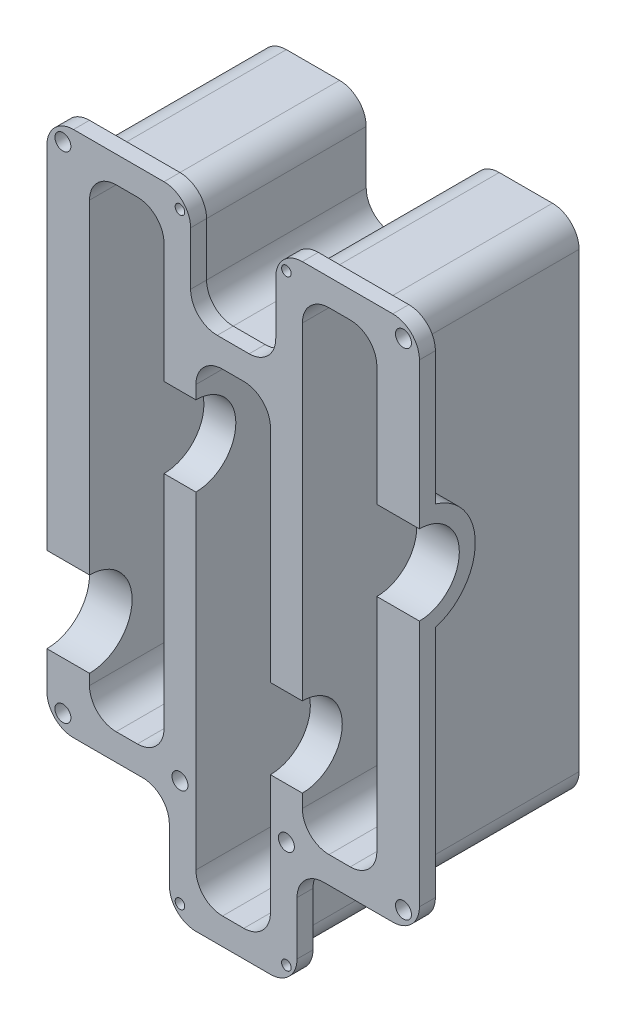
from build123d import *

# Parameters (mm, degrees)
SKETCH1_W           = 70
SKETCH1_H           = 119
BOSS_EXTRUDE1_DEPTH = 35
SKETCH2_R           = 8
CUT_EXTRUDE1_DEPTH  = 8
CUT_EXTRUDE2_DEPTH  = 32
SKETCH4_R           = 7.5
CUT_EXTRUDE3_DEPTH  = 8
SKETCH5_W           = 16
SKETCH5_H           = 20
SKETCH5_W_2         = 23
CUT_EXTRUDE4_DEPTH  = 78.396705356
CUT_EXTRUDE5_DEPTH  = 5
SKETCH7_W           = 18
SKETCH7_H           = 32
CUT_EXTRUDE6_DEPTH  = 2
SKETCH8_W           = 32
SKETCH8_H           = 22
CUT_EXTRUDE7_DEPTH  = 2
SKETCH9_W           = 22
SKETCH9_H           = 32
CUT_EXTRUDE8_DEPTH  = 2
SKETCH10_W          = 32
SKETCH10_H          = 18
CUT_EXTRUDE9_DEPTH  = 2
SKETCH11_W          = 25
SKETCH11_H          = 32
CUT_EXTRUDE10_DEPTH = 2
CUT_EXTRUDE11_DEPTH = 5
SKETCH13_W          = 22
SKETCH13_H          = 32
CUT_EXTRUDE12_DEPTH = 2
SKETCH14_W          = 32
SKETCH14_H          = 18
CUT_EXTRUDE13_DEPTH = 2
SKETCH15_W          = 18
SKETCH15_H          = 32
CUT_EXTRUDE14_DEPTH = 2
SKETCH16_W          = 32
SKETCH16_H          = 20
CUT_EXTRUDE15_DEPTH = 2
FILLET1_R           = 5
FILLET3_R           = 5
FILLET4_R           = 5
SKETCH17_R          = 1.5
CUT_EXTRUDE16_DEPTH = 10
SKETCH18_R          = 0.9
CUT_EXTRUDE17_DEPTH = 10
BOSS_EXTRUDE2_START = -6
BOSS_EXTRUDE2_DEPTH = 6
BOSS_EXTRUDE3_DEPTH = 6


with BuildPart() as part:
    # Sketch1 → Boss-Extrude1 (new body)
    with BuildSketch(Plane.XY):
        Rectangle(SKETCH1_W, SKETCH1_H)
    extrude(amount=BOSS_EXTRUDE1_DEPTH)

    # Sketch2 → Cut-Extrude1 (cut)
    with BuildSketch(Plane.ZY.offset(35)):
        with Locations((35, -19.5)):
            Circle(SKETCH2_R)
    extrude(amount=-CUT_EXTRUDE1_DEPTH, mode=Mode.SUBTRACT)

    # Sketch3 → Cut-Extrude2 (cut)
    with BuildSketch(Plane.XY.offset(35)):
        Polygon((-27, -34.5), (-13, -34.5), (-13, 12), (-7, 12), (-7, -54.5), (7, -54.5), (7, -27), (13, -27), (13, -34.5), (27, -34.5), (27, 54.5), (13, 54.5), (13, -12), (7, -12), (7, 34.5), (-7, 34.5), (-7, 27), (-13, 27), (-13, 54.5), (-27, 54.5), align=None)
    extrude(amount=-CUT_EXTRUDE2_DEPTH, mode=Mode.SUBTRACT)

    # Sketch4 → Cut-Extrude3 (cut)
    with BuildSketch(Plane(origin=(35, 0, 0), x_dir=(0, 0, -1), z_dir=(1, 0, 0))):
        with Locations((-35, 19.5)):
            Circle(SKETCH4_R)
    extrude(amount=-CUT_EXTRUDE3_DEPTH, mode=Mode.SUBTRACT)

    # Sketch5 → Cut-Extrude4 (cut, through all)
    with BuildSketch(Plane.XY.offset(35)):
        with Locations((0, 49.5)):
            Rectangle(SKETCH5_W, SKETCH5_H)
        with Locations((23.5, -49.5)):
            Rectangle(SKETCH5_W_2, SKETCH5_H)
        with Locations((-23.5, -49.5)):
            Rectangle(SKETCH5_W_2, SKETCH5_H)
    extrude(amount=-CUT_EXTRUDE4_DEPTH, mode=Mode.SUBTRACT)

    # Sketch6 → Cut-Extrude5 (cut)
    with BuildSketch(Plane.ZY.offset(35)):
        with BuildLine():
            Line((32, 59.5), (0, 59.5))
            Line((0, 59.5), (0, -39.5))
            Line((0, -39.5), (32, -39.5))
            Line((32, -39.5), (32, -30.083005244))
            ThreePointArc((32, -30.083005244), (24, -19.5), (32, -8.916994756))
            Line((32, -8.916994756), (32, 59.5))
        make_face()
    extrude(amount=-CUT_EXTRUDE5_DEPTH, mode=Mode.SUBTRACT)

    # Sketch7 → Cut-Extrude6 (cut)
    with BuildSketch(Plane.XZ.offset(39.5)):
        with Locations((-21, 16)):
            Rectangle(SKETCH7_W, SKETCH7_H)
    extrude(amount=-CUT_EXTRUDE6_DEPTH, mode=Mode.SUBTRACT)

    # Sketch8 → Cut-Extrude7 (cut)
    with BuildSketch(Plane.ZY.offset(12)):
        with Locations((16, -48.5)):
            Rectangle(SKETCH8_W, SKETCH8_H)
    extrude(amount=-CUT_EXTRUDE7_DEPTH, mode=Mode.SUBTRACT)

    # Sketch9 → Cut-Extrude8 (cut)
    with BuildSketch(Plane.XZ.offset(59.5)):
        with Locations((1, 16)):
            Rectangle(SKETCH9_W, SKETCH9_H)
    extrude(amount=-CUT_EXTRUDE8_DEPTH, mode=Mode.SUBTRACT)

    # Sketch10 → Cut-Extrude9 (cut)
    with BuildSketch(Plane(origin=(12, 0, 0), x_dir=(0, 0, -1), z_dir=(1, 0, 0))):
        with Locations((-16, -48.5)):
            Rectangle(SKETCH10_W, SKETCH10_H)
    extrude(amount=-CUT_EXTRUDE9_DEPTH, mode=Mode.SUBTRACT)

    # Sketch11 → Cut-Extrude10 (cut)
    with BuildSketch(Plane.XZ.offset(39.5)):
        with Locations((22.5, 16)):
            Rectangle(SKETCH11_W, SKETCH11_H)
    extrude(amount=-CUT_EXTRUDE10_DEPTH, mode=Mode.SUBTRACT)

    # Sketch12 → Cut-Extrude11 (cut)
    with BuildSketch(Plane(origin=(35, 0, 0), x_dir=(0, 0, -1), z_dir=(1, 0, 0))):
        with BuildLine():
            Line((-32, 59.5), (0, 59.5))
            Line((0, 59.5), (0, -37.5))
            Line((0, -37.5), (-32, -37.5))
            Line((-32, -37.5), (-32, 9.437694101))
            ThreePointArc((-32, 9.437694101), (-24.5, 19.5), (-32, 29.562305899))
            Line((-32, 29.562305899), (-32, 59.5))
        make_face()
    extrude(amount=-CUT_EXTRUDE11_DEPTH, mode=Mode.SUBTRACT)

    # Sketch13 → Cut-Extrude12 (cut)
    with BuildSketch(Plane(origin=(0, 59.5, 0), x_dir=(1, 0, 0), z_dir=(0, 1, 0))):
        with Locations((19, -16)):
            Rectangle(SKETCH13_W, SKETCH13_H)
        with Locations((-19, -16)):
            Rectangle(SKETCH13_W, SKETCH13_H)
    extrude(amount=-CUT_EXTRUDE12_DEPTH, mode=Mode.SUBTRACT)

    # Sketch14 → Cut-Extrude13 (cut)
    with BuildSketch(Plane.ZY.offset(-8)):
        with Locations((16, 48.5)):
            Rectangle(SKETCH14_W, SKETCH14_H)
    extrude(amount=-CUT_EXTRUDE13_DEPTH, mode=Mode.SUBTRACT)

    # Sketch15 → Cut-Extrude14 (cut)
    with BuildSketch(Plane(origin=(0, 39.5, 0), x_dir=(1, 0, 0), z_dir=(0, 1, 0))):
        with Locations((1, -16)):
            Rectangle(SKETCH15_W, SKETCH15_H)
    extrude(amount=-CUT_EXTRUDE14_DEPTH, mode=Mode.SUBTRACT)

    # Sketch16 → Cut-Extrude15 (cut)
    with BuildSketch(Plane(origin=(-8, 0, 0), x_dir=(0, 0, -1), z_dir=(1, 0, 0))):
        with Locations((-16, 47.5)):
            Rectangle(SKETCH16_W, SKETCH16_H)
    extrude(amount=-CUT_EXTRUDE15_DEPTH, mode=Mode.SUBTRACT)

    # Fillet1
    fillet1_edges = [part.edges().sort_by_distance(p)[0] for p in [
        (-27, -34.5, 19),
        (-27, 54.5, 19),
        (-13, 54.5, 19),
        (-7, 34.5, 19),
        (7, 34.5, 19),
        (13, 54.5, 19),
        (27, 54.5, 19),
        (27, -34.5, 19),
        (13, -34.5, 19),
        (7, -54.5, 19),
        (-7, -54.5, 19),
        (-13, -34.5, 19),
    ]]
    fillet(fillet1_edges, radius=FILLET1_R)

    # Fillet3
    fillet3_edges = [part.edges().sort_by_distance(p)[0] for p in [
        (-30, -37.5, 16),
        (-10, -37.5, 16),
        (-10, -57.5, 16),
        (10, -57.5, 16),
        (10, -37.5, 16),
        (30, -37.5, 16),
        (30, 57.5, 16),
        (-30, 57.5, 16),
        (10, 57.5, 16),
        (10, 37.5, 16),
        (-10, 57.5, 16),
        (-10, 37.5, 16),
    ]]
    fillet(fillet3_edges, radius=FILLET3_R)

    # Fillet4
    fillet4_edges = [part.edges().sort_by_distance(p)[0] for p in [
        (-35, -39.5, 33.5),
        (-12, -39.5, 33.5),
        (-12, -59.5, 33.5),
        (12, -59.5, 33.5),
        (12, -39.5, 33.5),
        (35, -39.5, 33.5),
        (8, 59.5, 33.5),
        (-8, 59.5, 33.5),
        (8, 39.5, 33.5),
        (-8, 39.5, 33.5),
        (-35, 59.5, 33.5),
        (35, 59.5, 33.5),
    ]]
    fillet(fillet4_edges, radius=FILLET4_R)

    # Sketch17 → Cut-Extrude16 (cut)
    with BuildSketch(Plane.XY.offset(35)):
        with Locations((-32, 56.5)):
            Circle(SKETCH17_R)
        with Locations((32, 56.5)):
            Circle(SKETCH17_R)
        with Locations((32, -36.5)):
            Circle(SKETCH17_R)
        with Locations((-32, -36.5)):
            Circle(SKETCH17_R)
        with Locations((-10, -36.5)):
            Circle(SKETCH17_R)
        with Locations((10, -36.5)):
            Circle(SKETCH17_R)
    extrude(amount=-CUT_EXTRUDE16_DEPTH, mode=Mode.SUBTRACT)

    # Sketch18 → Cut-Extrude17 (cut)
    with BuildSketch(Plane.XY.offset(35)):
        with Locations((-10, 56.5)):
            Circle(SKETCH18_R)
        with Locations((10, 56.5)):
            Circle(SKETCH18_R)
        with Locations((-10, -56.5)):
            Circle(SKETCH18_R)
        with Locations((10, -56.5)):
            Circle(SKETCH18_R)
    extrude(amount=-CUT_EXTRUDE17_DEPTH, mode=Mode.SUBTRACT)

    # Sketch19 → Boss-Extrude2 (add)
    with BuildSketch(Plane.ZY.offset(13).offset(BOSS_EXTRUDE2_START)):
        with BuildLine():
            Line((35, 27), (3, 27))
            Line((3, 27), (3, 12))
            Line((3, 12), (35, 12))
            ThreePointArc((35, 12), (27.5, 19.5), (35, 27))
        make_face()
    extrude(amount=BOSS_EXTRUDE2_DEPTH)

    # Sketch20 → Boss-Extrude3 (add)
    with BuildSketch(Plane.ZY.offset(-7)):
        with BuildLine():
            Line((35, -12), (3, -12))
            Line((3, -12), (3, -27))
            Line((3, -27), (35, -27))
            ThreePointArc((35, -27), (27.5, -19.5), (35, -12))
        make_face()
    extrude(amount=-BOSS_EXTRUDE3_DEPTH)


solid = part.part
